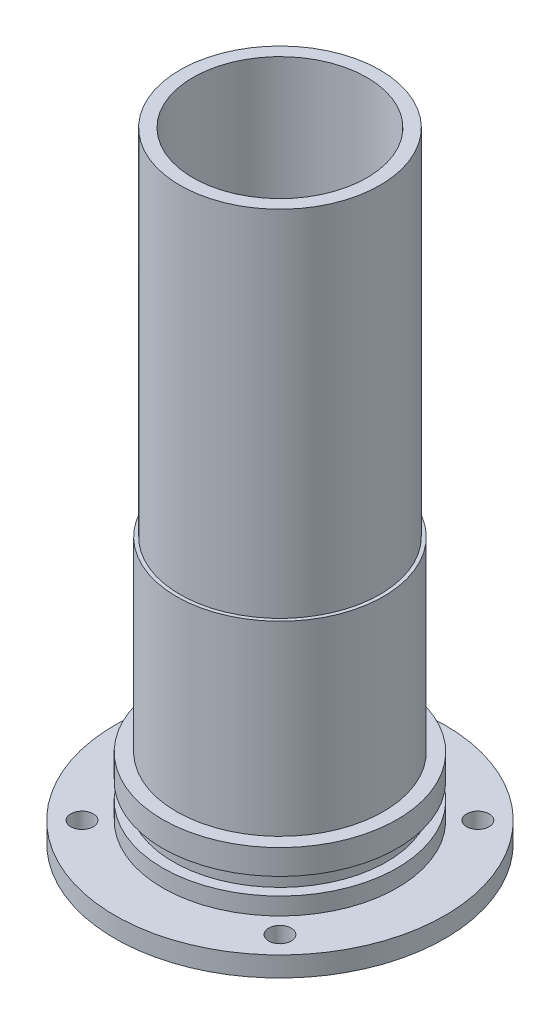
from build123d import *

# Parameters (mm, degrees)
CUT_EXTRUDE1_REACH = 134.492
SKETCH2_R          = 2.25


with BuildPart() as part:
    # Sketch1 → Revolve1 (revolve)
    with BuildSketch(Plane.XY, mode=Mode.PRIVATE) as revolve1_sk:
        Polygon((17.4, 0), (17.4, 124), (20, 124), (20, 53.11246026), (20.7, 53.11246026), (20.7, 15.85), (23.45, 15.85), (23.45, 10.85), (21.33256308, 10.85), (21.33256308, 7.45), (23.45, 7.45), (23.45, 4), (33, 4), (33, 0), align=None)
    revolve(revolve1_sk.sketch.rotate(Axis((0, 0, 0), (0, 1, 0)), 90), axis=Axis((0, 0, 0), (0, 1, 0)))

    # Sketch2 → Cut-Extrude1 (cut, up to next)
    with BuildSketch(Plane.XZ, mode=Mode.PRIVATE) as cut_extrude1_sk1:
        with Locations(Location((-19.798989873, 19.798989873, 0), (0, 0, 270))):
            Circle(SKETCH2_R)
    cut_extrude1_tool1 = extrude(cut_extrude1_sk1.sketch, amount=-CUT_EXTRUDE1_REACH, mode=Mode.PRIVATE) & part.part
    # Sketch2 → Cut-Extrude1 (cut, up to next)
    with BuildSketch(Plane.XZ, mode=Mode.PRIVATE) as cut_extrude1_sk2:
        with Locations(Location((19.798989873, 19.798989873, 0), (0, 0, 270))):
            Circle(SKETCH2_R)
    cut_extrude1_tool2 = extrude(cut_extrude1_sk2.sketch, amount=-CUT_EXTRUDE1_REACH, mode=Mode.PRIVATE) & part.part
    # Sketch2 → Cut-Extrude1 (cut, up to next)
    with BuildSketch(Plane.XZ, mode=Mode.PRIVATE) as cut_extrude1_sk3:
        with Locations(Location((19.798989873, -19.798989873, 0), (0, 0, 270))):
            Circle(SKETCH2_R)
    cut_extrude1_tool3 = extrude(cut_extrude1_sk3.sketch, amount=-CUT_EXTRUDE1_REACH, mode=Mode.PRIVATE) & part.part
    # Sketch2 → Cut-Extrude1 (cut, up to next)
    with BuildSketch(Plane.XZ, mode=Mode.PRIVATE) as cut_extrude1_sk4:
        with Locations(Location((-19.798989873, -19.798989873, 0), (0, 0, 270))):
            Circle(SKETCH2_R)
    cut_extrude1_tool4 = extrude(cut_extrude1_sk4.sketch, amount=-CUT_EXTRUDE1_REACH, mode=Mode.PRIVATE) & part.part
    add(cut_extrude1_tool1.solids().sort_by_distance((-19.79899, 0, 19.79899))[0], mode=Mode.SUBTRACT)
    add(cut_extrude1_tool2.solids().sort_by_distance((19.79899, 0, 19.79899))[0], mode=Mode.SUBTRACT)
    add(cut_extrude1_tool3.solids().sort_by_distance((19.79899, 0, -19.79899))[0], mode=Mode.SUBTRACT)
    add(cut_extrude1_tool4.solids().sort_by_distance((-19.79899, 0, -19.79899))[0], mode=Mode.SUBTRACT)


solid = part.part
